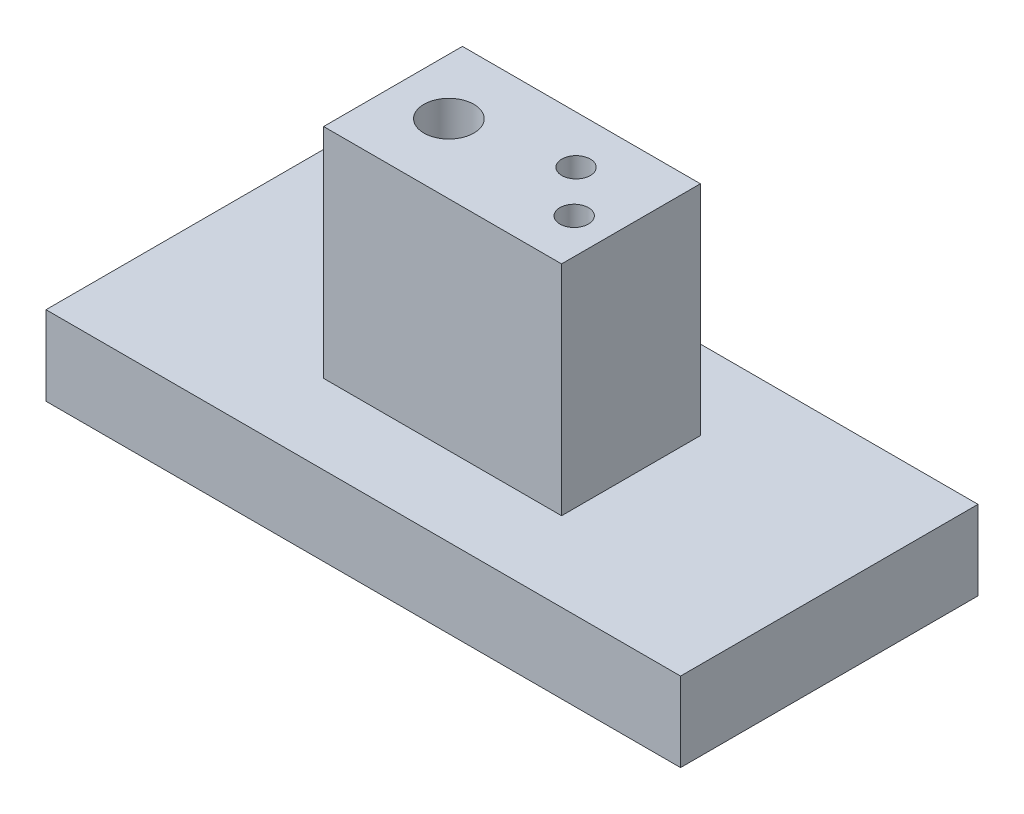
from build123d import *

# Parameters (mm, degrees)
SKETCH1_W                            = 6
SKETCH1_H                            = 3.5
SKETCH1_R                            = 0.36
SKETCH1_R_2                          = 0.63
CANULALAYOUT_BOSS_EXTRUDE1_DEPTH     = 5.5
SKETCH2_W                            = 16
SKETCH2_H                            = 7.5
SKETCH2_R                            = 0.25
BASE_BOSS_EXTRUDE2_DEPTH             = 2
SKETCH3_R                            = 0.63
SKETCH3_R_2                          = 0.25
HEIGHTDIFFERENCE_BOSS_EXTRUDE3_DEPTH = 0.2


with BuildPart() as part:
    # Sketch1 → CanulaLayout-Boss-Extrude1 (new body)
    with BuildSketch(Plane(origin=(0, 0, 0), x_dir=(1, 0, 0), z_dir=(0, 1, 0))):
        Rectangle(SKETCH1_W, SKETCH1_H)
        with Locations(Location((1.072966062, 0.541981393, 0), (0, 0, 270))):
            Circle(SKETCH1_R, mode=Mode.SUBTRACT)
        with Locations(Location((2.109800031, -0.541981393, 0), (0, 0, 270))):
            Circle(SKETCH1_R, mode=Mode.SUBTRACT)
        with Locations(Location((-1.591383046, 0, 0), (0, 0, 270))):
            Circle(SKETCH1_R_2, mode=Mode.SUBTRACT)
    extrude(amount=CANULALAYOUT_BOSS_EXTRUDE1_DEPTH)

    # Sketch2 → Base-Boss-Extrude2 (add)
    with BuildSketch(Plane.XZ):
        Rectangle(SKETCH2_W, SKETCH2_H)
        with Locations(Location((2.109800031, 0.541981393, 0), (0, 0, 270))):
            Circle(SKETCH2_R, mode=Mode.SUBTRACT)
        with Locations(Location((1.072966062, -0.541981393, 0), (0, 0, 270))):
            Circle(SKETCH2_R, mode=Mode.SUBTRACT)
        with Locations(Location((-1.591383046, 0, 0), (0, 0, 270))):
            Circle(SKETCH2_R, mode=Mode.SUBTRACT)
    extrude(amount=BASE_BOSS_EXTRUDE2_DEPTH)

    # Sketch3 → HeightDifference-Boss-Extrude3 (add)
    with BuildSketch(Plane(origin=(0, 0, 0), x_dir=(1, 0, 0), z_dir=(0, 1, 0))):
        with Locations(Location((-1.591383046, 0, 0), (0, 0, 270))):
            Circle(SKETCH3_R)
        with Locations(Location((-1.591383046, 0, 0), (0, 0, 270))):
            Circle(SKETCH3_R_2, mode=Mode.SUBTRACT)
    extrude(amount=HEIGHTDIFFERENCE_BOSS_EXTRUDE3_DEPTH)


solid = part.part
